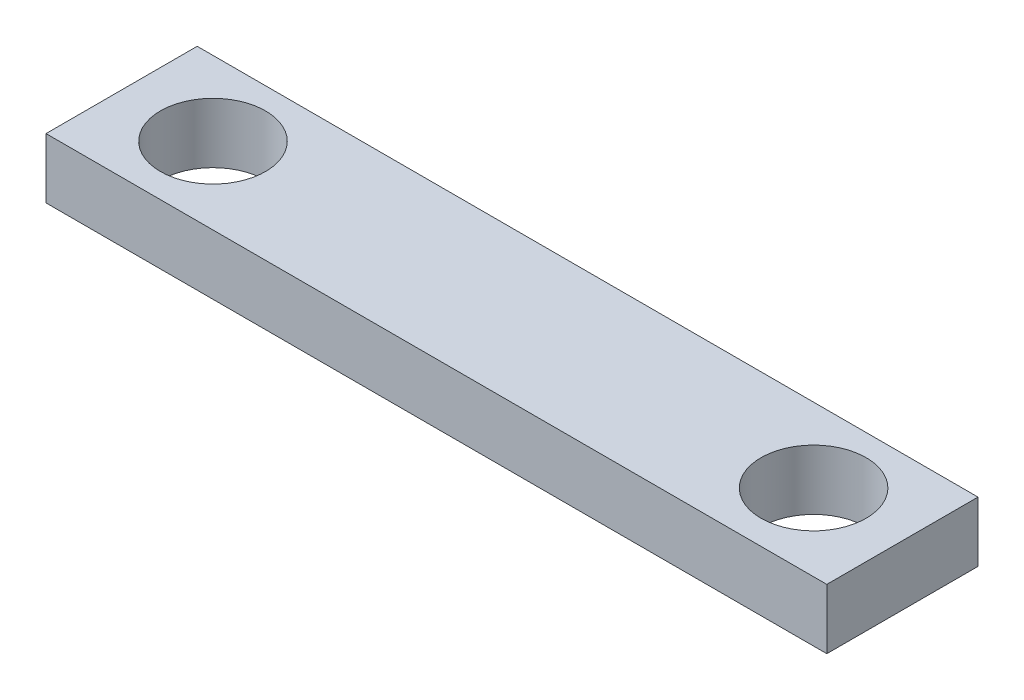
from build123d import *

# Parameters (mm, degrees)
SKETCH_1_W      = 26
SKETCH_1_H      = 5.034755363
SKETCH_1_R      = 1.75
EXTRUDE_1_DEPTH = 2


with BuildPart() as part:
    # 草图1 → 凸台-拉伸1 (new body)
    with BuildSketch(Plane(origin=(0, 0, 0), x_dir=(1, 0, 0), z_dir=(0, 1, 0))):
        with Locations((4.381181498, 0.341339346)):
            Rectangle(SKETCH_1_W, SKETCH_1_H)
        with Locations(Location((-5.618818502, 0.384006765, 0), (0, 0, 270))):
            Circle(SKETCH_1_R, mode=Mode.SUBTRACT)
        with Locations(Location((14.381181498, 0.384006765, 0), (0, 0, 270))):
            Circle(SKETCH_1_R, mode=Mode.SUBTRACT)
    extrude(amount=EXTRUDE_1_DEPTH)


solid = part.part
